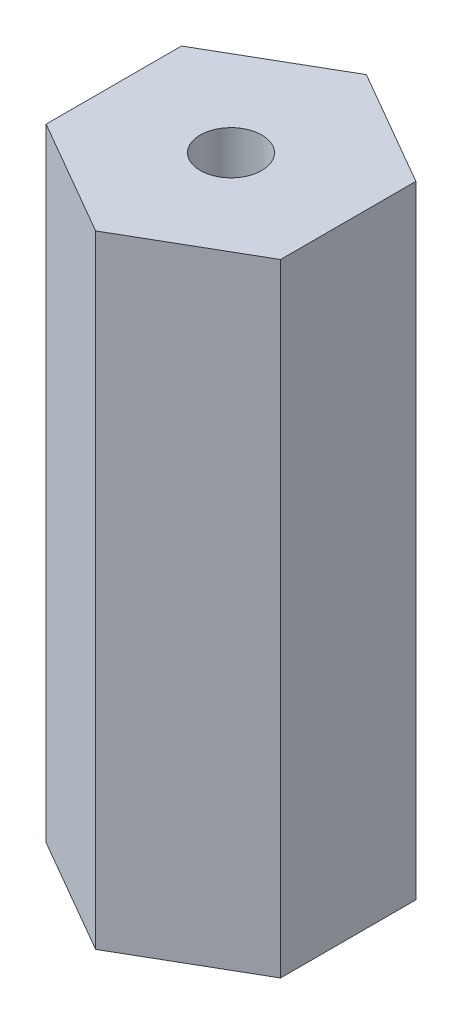
from build123d import *

# Parameters (mm, degrees)
BOSS_EXTRUDE1_DEPTH = 12
SKETCH3_R           = 0.593671867
CUT_EXTRUDE1_DEPTH  = 13.486955681


with BuildPart() as part:
    # Sketch1 → Boss-Extrude1 (new body)
    with BuildSketch(Plane(origin=(0, 0, 0), x_dir=(1, 0, 0), z_dir=(0, 1, 0))):
        Polygon((2.2606, 1.305158019), (0, 2.610316037), (-2.2606, 1.305158019), (-2.2606, -1.305158019), (0, -2.610316037), (2.2606, -1.305158019), align=None)
    extrude(amount=BOSS_EXTRUDE1_DEPTH)

    # Sketch3 → Cut-Extrude1 (cut, through all)
    with BuildSketch(Plane(origin=(0, 12, 0), x_dir=(1, 0, 0), z_dir=(0, 1, 0))):
        with Locations(Location((0, 0, 0), (0, 0, 270))):
            Circle(SKETCH3_R)
    extrude(amount=-CUT_EXTRUDE1_DEPTH, mode=Mode.SUBTRACT)


solid = part.part
